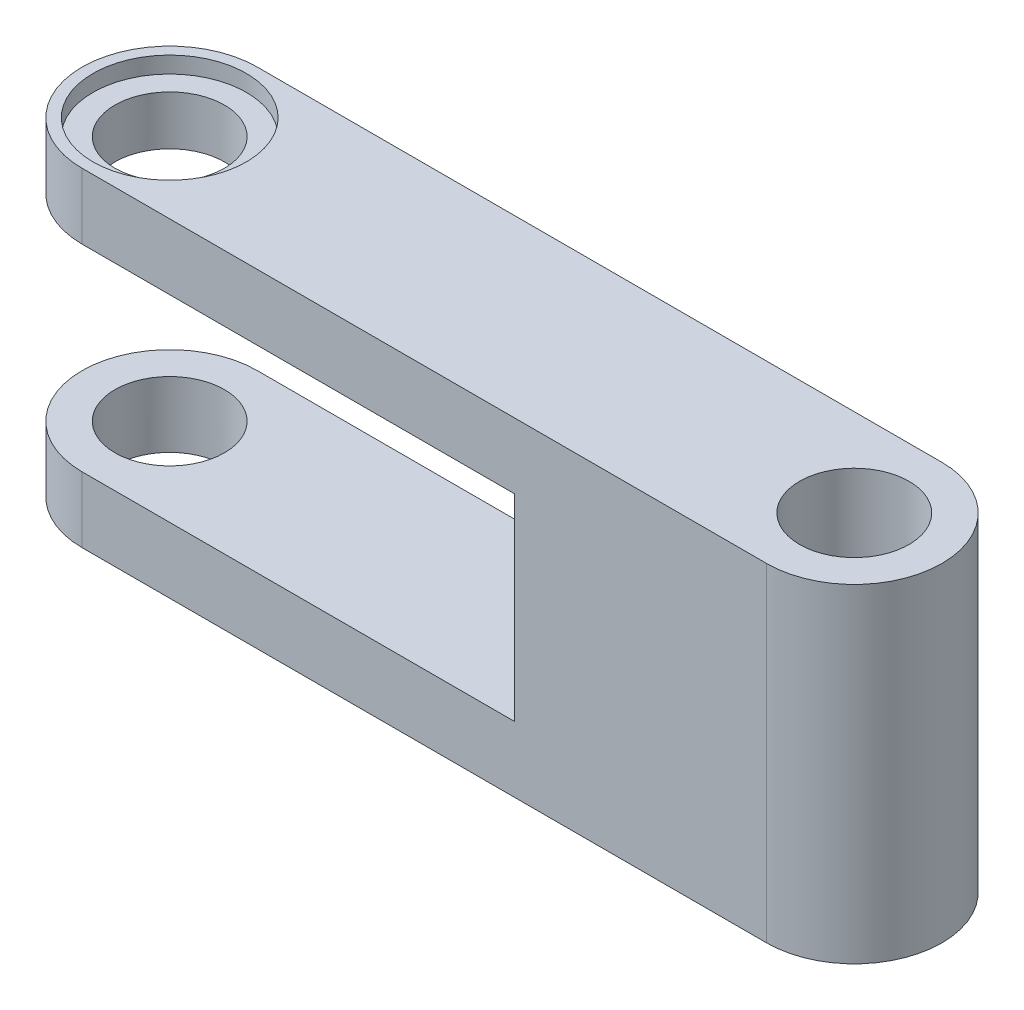
from build123d import *

# Parameters (mm, degrees)
EXTRUDE_1_DEPTH     = 60
CUT_EXTRUDE_1_REACH = 102.091
SKETCH_2_R          = 10
CUT_EXTRUDE_2_REACH = 102.091
SKETCH_3_R          = 10
SKETCH_4_R          = 14
CUT_EXTRUDE_3_DEPTH = 3
CUT_EXTRUDE_4_REACH = 105.857
SKETCH_6_W          = 115
SKETCH_6_H          = 36


with BuildPart() as part:
    # 草图1 → 凸台-拉伸1 (new body)
    with BuildSketch(Plane(origin=(0, 0, 0), x_dir=(1, 0, 0), z_dir=(0, 1, 0))):
        with BuildLine():
            Line((-62.5, 16), (62.5, 16))
            ThreePointArc((62.5, 16), (78.5, 0), (62.5, -16))
            Line((62.5, -16), (-62.5, -16))
            ThreePointArc((-62.5, -16), (-78.5, 0), (-62.5, 16))
        make_face()
    extrude(amount=EXTRUDE_1_DEPTH)

    # 草图2 → 切除-拉伸1 (cut, up to next)
    with BuildSketch(Plane(origin=(0, 60, 0), x_dir=(1, 0, 0), z_dir=(0, 1, 0)), mode=Mode.PRIVATE) as cut_extrude_1_sk1:
        with Locations((62.5, 0)):
            Circle(SKETCH_2_R)
    cut_extrude_1_tool1 = extrude(cut_extrude_1_sk1.sketch, amount=-CUT_EXTRUDE_1_REACH, mode=Mode.PRIVATE) & part.part
    add(cut_extrude_1_tool1.solids().sort_by_distance((62.5, 60, 0))[0], mode=Mode.SUBTRACT)

    # 草图3 → 切除-拉伸2 (cut, up to next)
    with BuildSketch(Plane(origin=(0, 60, 0), x_dir=(1, 0, 0), z_dir=(0, 1, 0)), mode=Mode.PRIVATE) as cut_extrude_2_sk1:
        with Locations((-62.5, 0)):
            Circle(SKETCH_3_R)
    cut_extrude_2_tool1 = extrude(cut_extrude_2_sk1.sketch, amount=-CUT_EXTRUDE_2_REACH, mode=Mode.PRIVATE) & part.part
    add(cut_extrude_2_tool1.solids().sort_by_distance((-62.5, 60, 0))[0], mode=Mode.SUBTRACT)

    # 草图4 → 切除-拉伸3 (cut)
    with BuildSketch(Plane(origin=(0, 60, 0), x_dir=(1, 0, 0), z_dir=(0, 1, 0))):
        with Locations((-62.5, 0)):
            Circle(SKETCH_4_R)
    extrude(amount=-CUT_EXTRUDE_3_DEPTH, mode=Mode.SUBTRACT)

    # 草图6 → 切除-拉伸4 (cut, up to next)
    with BuildSketch(Plane.XY.offset(16), mode=Mode.PRIVATE) as cut_extrude_4_sk1:
        with Locations((-41, 30)):
            Rectangle(SKETCH_6_W, SKETCH_6_H)
    cut_extrude_4_tool1 = extrude(cut_extrude_4_sk1.sketch, amount=-CUT_EXTRUDE_4_REACH, mode=Mode.PRIVATE) & part.part
    add(cut_extrude_4_tool1.solids().sort_by_distance((-41, 30, 16))[0], mode=Mode.SUBTRACT)


solid = part.part
